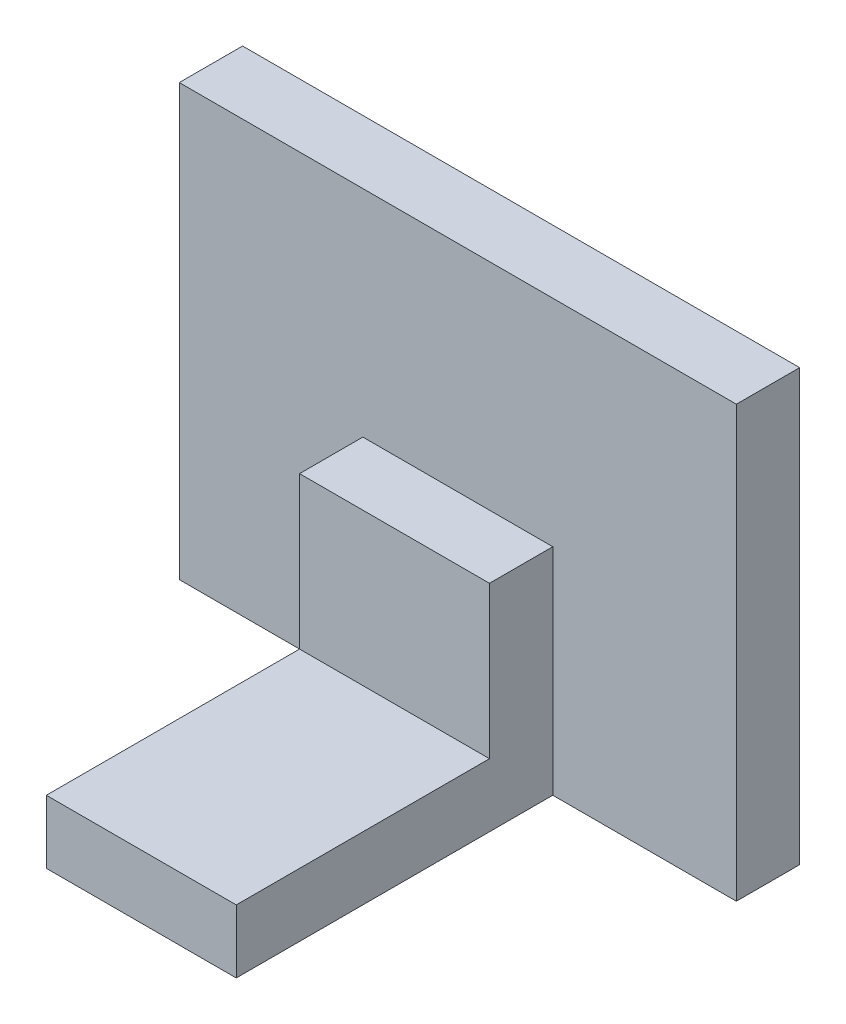
from build123d import *

# Parameters (mm, degrees)
SKETCH_1_W      = 44
SKETCH_1_H      = 34
EXTRUDE_1_DEPTH = 5
SKETCH_2_W      = 7
SKETCH_2_H      = 26
EXTRUDE_2_DEPTH = 1
SKETCH_3_W      = 15
SKETCH_3_H      = 17
EXTRUDE_3_DEPTH = 5
SKETCH_4_W      = 15
SKETCH_4_H      = 5
EXTRUDE_4_DEPTH = 20


with BuildPart() as part:
    # 스케치1 → 보스-돌출1 (new body)
    with BuildSketch(Plane.XY):
        Rectangle(SKETCH_1_W, SKETCH_1_H)
    extrude(amount=EXTRUDE_1_DEPTH)

    # 스케치2 → 보스-돌출2 (add)
    with BuildSketch(Plane(origin=(0, 0, 0), x_dir=(-1, 0, 0), z_dir=(0, 0, -1))):
        with Locations((-15, 0)):
            Rectangle(SKETCH_2_W, SKETCH_2_H)
    extrude_2 = extrude(amount=EXTRUDE_2_DEPTH)

    # 대칭 복사1: 보스-돌출2 across plane
    add(extrude_2.mirror(Plane(origin=(0, 0, 0), x_dir=(0, 0, 1), z_dir=(1, 0, 0))))

    # 스케치3 → 보스-돌출3 (add)
    with BuildSketch(Plane.XY.offset(5)):
        with Locations((0, -8.5)):
            Rectangle(SKETCH_3_W, SKETCH_3_H)
    extrude(amount=EXTRUDE_3_DEPTH)

    # 스케치4 → 보스-돌출4 (add)
    with BuildSketch(Plane.XY.offset(10)):
        with Locations((0, -14.5)):
            Rectangle(SKETCH_4_W, SKETCH_4_H)
    extrude(amount=EXTRUDE_4_DEPTH)


solid = part.part
